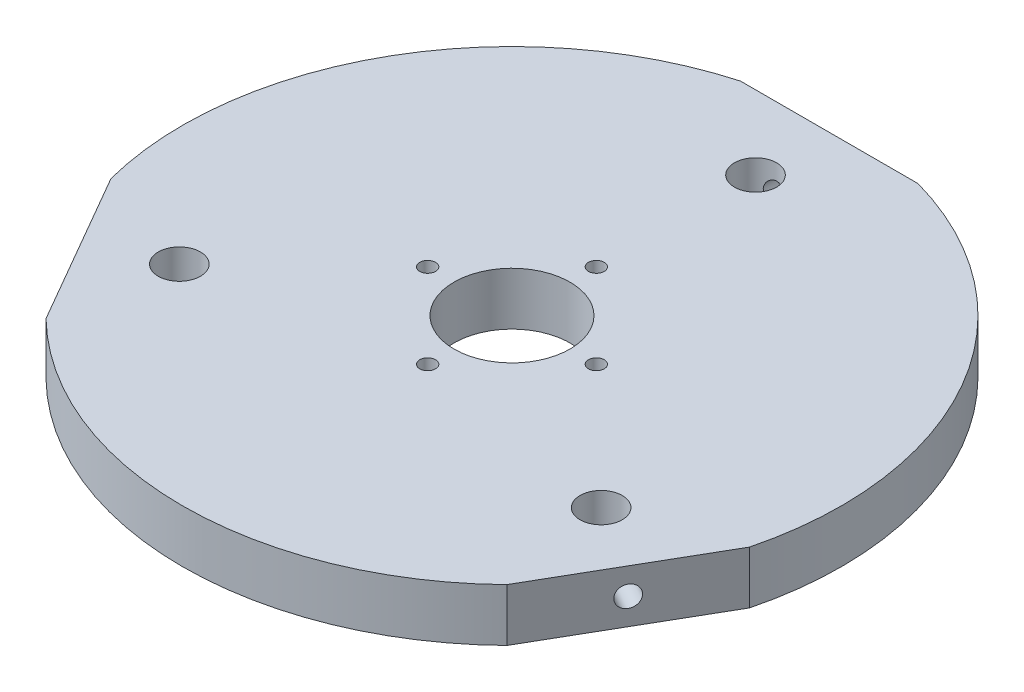
from build123d import *

# Parameters (mm, degrees)
SKETCH1_R           = 62.5
SKETCH1_R_2         = 4
BOSS_EXTRUDE1_DEPTH = 10
SKETCH2_W           = 43.972180284
SKETCH2_H           = 8.711954994
CUT_EXTRUDE1_DEPTH  = 10
SKETCH3_R           = 2
CUT_EXTRUDE2_DEPTH  = 12
SKETCH4_R           = 2
CUT_EXTRUDE3_DEPTH  = 12
SKETCH5_R           = 2
CUT_EXTRUDE4_DEPTH  = 12
SKETCH6_R           = 11
CUT_EXTRUDE5_DEPTH  = 12
SKETCH7_R           = 1.5
CUT_EXTRUDE6_DEPTH  = 10


with BuildPart() as part:
    # Sketch1 → Boss-Extrude1 (new body)
    with BuildSketch(Plane(origin=(0, 0, 0), x_dir=(1, 0, 0), z_dir=(0, 1, 0))):
        with Locations(Location((0, 0, 0), (0, 0, 270))):
            Circle(SKETCH1_R)
        with Locations(Location((0, 46.188021535, 0), (0, 0, 270))):
            Circle(SKETCH1_R_2, mode=Mode.SUBTRACT)
        with Locations(Location((40, -23.094010768, 0), (0, 0, 270))):
            Circle(SKETCH1_R_2, mode=Mode.SUBTRACT)
        with Locations(Location((-40, -23.094010768, 0), (0, 0, 270))):
            Circle(SKETCH1_R_2, mode=Mode.SUBTRACT)
    extrude(amount=BOSS_EXTRUDE1_DEPTH)

    # Sketch2 → Cut-Extrude1 (cut)
    with BuildSketch(Plane(origin=(0, 10, 0), x_dir=(1, 0, 0), z_dir=(0, 1, 0))):
        Polygon((-39.581845605, -51.818275424), (-64.713070734, -8.289716646), (-77.687460418, -15.780484023), (-52.55623529, -59.309042801), align=None)
        Polygon((40.609652539, -50.038061596), (63.321086643, -10.700703814), (75.641288558, -17.813775707), (52.929854454, -57.151133488), align=None)
        with Locations((0.471086747, 64.543999032)):
            Rectangle(SKETCH2_W, SKETCH2_H)
    extrude(amount=-CUT_EXTRUDE1_DEPTH, mode=Mode.SUBTRACT)

    # Sketch3 → Cut-Extrude2 (cut)
    with BuildSketch(Plane(origin=(52.124355653, 0, 30.094010768), x_dir=(0.49999999999999983, 0, -0.8660254037844387), z_dir=(0.8660254037844387, 0, 0.49999999999999983))):
        with Locations((0.001973272, 5)):
            Circle(SKETCH3_R)
    extrude(amount=-CUT_EXTRUDE2_DEPTH, mode=Mode.SUBTRACT)

    # Sketch4 → Cut-Extrude3 (cut)
    with BuildSketch(Plane(origin=(-52.124355653, 0, 30.094010768), x_dir=(0.5000000000000002, 0, 0.8660254037844386), z_dir=(-0.8660254037844385, 0, 0.5000000000000001))):
        with Locations((-0.001973272, 5)):
            Circle(SKETCH4_R)
    extrude(amount=-CUT_EXTRUDE3_DEPTH, mode=Mode.SUBTRACT)

    # Sketch5 → Cut-Extrude4 (cut)
    with BuildSketch(Plane(origin=(0, 0, -60.188021535), x_dir=(-1, 0, 0), z_dir=(0, 0, -1))):
        with Locations((-0.001973272, 5)):
            Circle(SKETCH5_R)
    extrude(amount=-CUT_EXTRUDE4_DEPTH, mode=Mode.SUBTRACT)

    # Sketch6 → Cut-Extrude5 (cut)
    with BuildSketch(Plane(origin=(0, 10, 0), x_dir=(1, 0, 0), z_dir=(0, 1, 0))):
        with Locations(Location((0, 0, 0), (0, 0, 270))):
            Circle(SKETCH6_R)
    extrude(amount=-CUT_EXTRUDE5_DEPTH, mode=Mode.SUBTRACT)

    # Sketch7 → Cut-Extrude6 (cut)
    with BuildSketch(Plane(origin=(0, 10, 0), x_dir=(1, 0, 0), z_dir=(0, 1, 0))):
        with Locations(Location((-16, 0, 0), (0, 0, 270))):
            Circle(SKETCH7_R)
        with Locations(Location((0, 16, 0), (0, 0, 270))):
            Circle(SKETCH7_R)
        with Locations(Location((16, 0, 0), (0, 0, 270))):
            Circle(SKETCH7_R)
        with Locations(Location((0, -16, 0), (0, 0, 270))):
            Circle(SKETCH7_R)
    extrude(amount=-CUT_EXTRUDE6_DEPTH, mode=Mode.SUBTRACT)


solid = part.part
